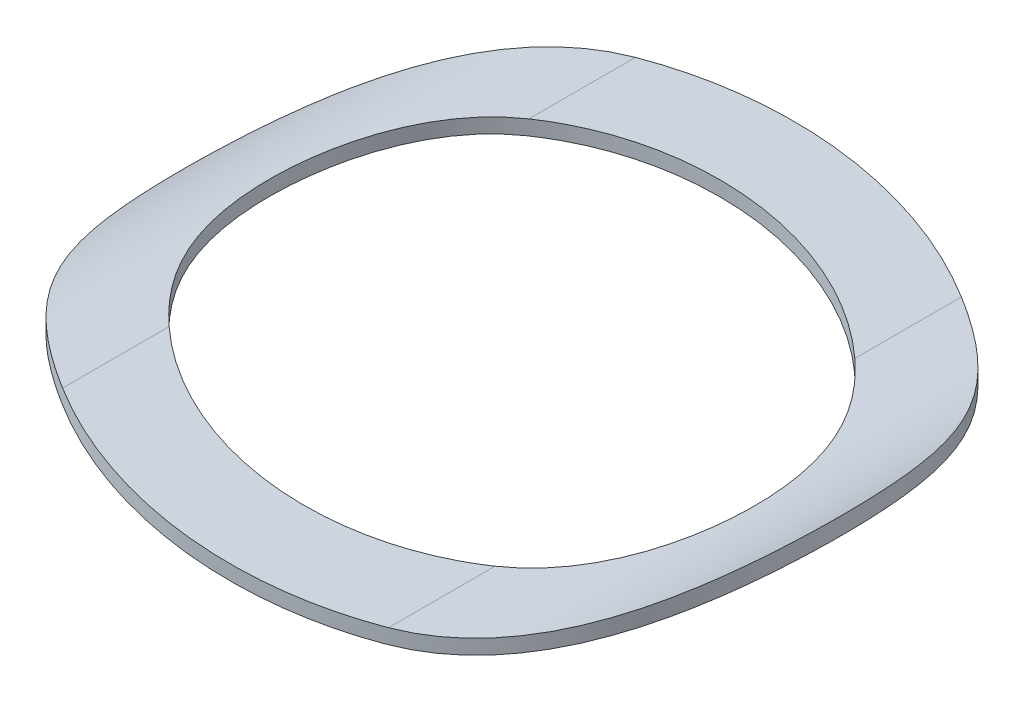
from build123d import *

# Parameters (mm, degrees)
EXTRUDE_THIN1_DEPTH = 15
SKETCH2_OUTSIDE_W   = 38.632
SKETCH2_OUTSIDE_H   = 40.272
SKETCH2_OUTSIDE_R   = 13.44
SKETCH2_OUTSIDE_R_2 = 9.9
EXTRUDE1_DEPTH      = 30


with BuildPart() as part:
    # Sketch1 → Extrude-Thin1 (new, symmetric)
    with BuildSketch(Plane.XY):
        with BuildLine():
            ThreePointArc((14, 0), (10.511476834, -1.679487802), (6.646471406, -1.907974583))
            Line((6.646471406, -1.907974583), (-6.646471406, -0.092025417))
            ThreePointArc((-6.646471406, -0.092025417), (-10.511476834, -0.320512198), (-14, -2))
            Line((-14, -2), (-13.64, -2.48))
            ThreePointArc((-13.64, -2.48), (-10.360788224, -0.901281466), (-6.727683122, -0.686503892))
            Line((-6.727683122, -0.686503892), (6.565259691, -2.502453058))
            ThreePointArc((6.565259691, -2.502453058), (10.662165444, -2.26025707), (14.36, -0.48))
            Line((14.36, -0.48), (14, 0))
        make_face()
    extrude(amount=EXTRUDE_THIN1_DEPTH, both=True)

    # Sketch2 outside → Extrude1 (cut)
    # profile 1 of 2: a face of its own
    with BuildSketch(Plane(origin=(0, 0, 0), x_dir=(1, 0, 0), z_dir=(0, 1, 0))):
        with Locations((0.18, 0)):
            Rectangle(SKETCH2_OUTSIDE_W, SKETCH2_OUTSIDE_H)
        with Locations(Location((0, 0, 0), (0, 0, 299.241157593))):
            Circle(SKETCH2_OUTSIDE_R, mode=Mode.SUBTRACT)
    # profile 2 of 2: a face of its own
    with BuildSketch(Plane(origin=(0, 0, 0), x_dir=(1, 0, 0), z_dir=(0, 1, 0))):
        with Locations(Location((0, 0, 0), (0, 0, 311.541132012))):
            Circle(SKETCH2_OUTSIDE_R_2)
    extrude(amount=-EXTRUDE1_DEPTH, mode=Mode.SUBTRACT)


solid = part.part
